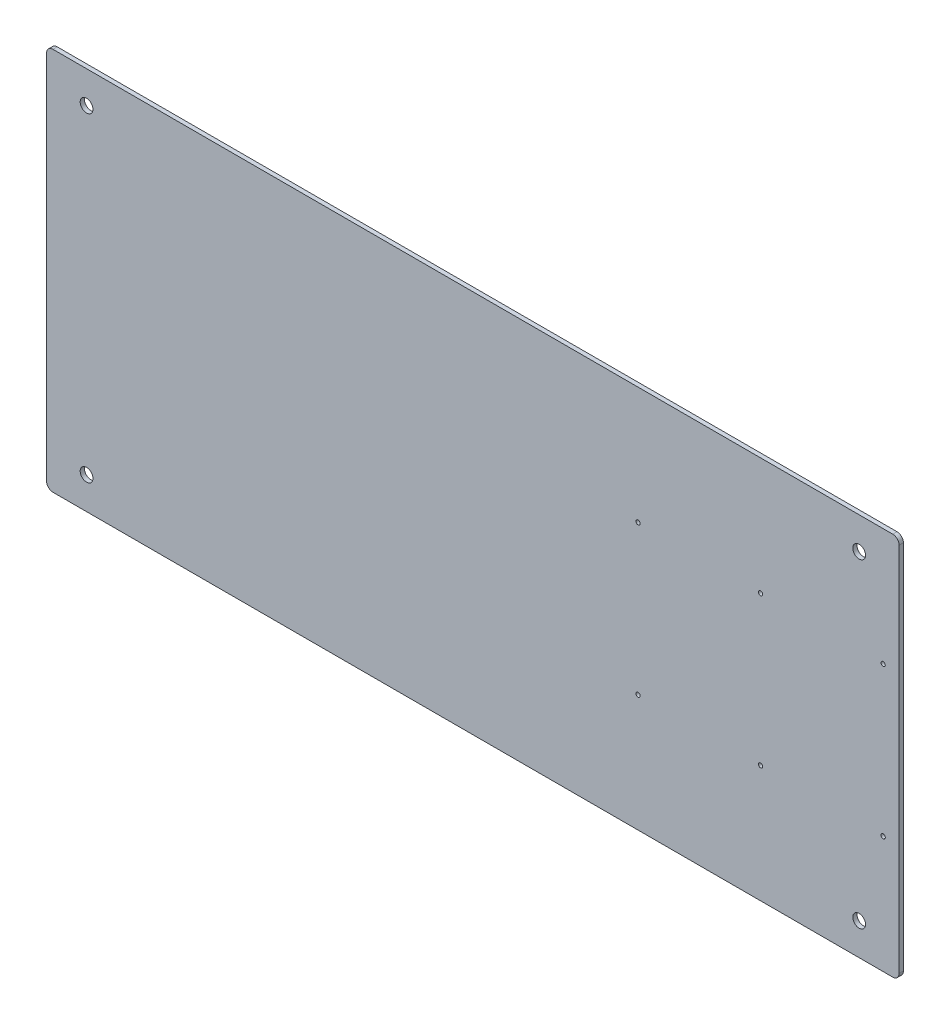
from build123d import *

# Parameters (mm, degrees)
SKETCH_1_W      = 800
SKETCH_1_H      = 360
SKETCH_1_R      = 6
SKETCH_1_R_2    = 2
EXTRUDE_1_DEPTH = 4
FILLET_1_R      = 6


with BuildPart() as part:
    # 草图1 → 凸台-拉伸1 (new body)
    with BuildSketch(Plane.XY):
        Rectangle(SKETCH_1_W, SKETCH_1_H)
        with Locations((-362.5, 150)):
            Circle(SKETCH_1_R, mode=Mode.SUBTRACT)
        with Locations((-362.5, -150)):
            Circle(SKETCH_1_R, mode=Mode.SUBTRACT)
        with Locations((362.5, -150)):
            Circle(SKETCH_1_R, mode=Mode.SUBTRACT)
        with Locations((362.5, 150)):
            Circle(SKETCH_1_R, mode=Mode.SUBTRACT)
        with Locations((155, 70)):
            Circle(SKETCH_1_R_2, mode=Mode.SUBTRACT)
        with Locations((270, 70)):
            Circle(SKETCH_1_R_2, mode=Mode.SUBTRACT)
        with Locations((385, 70)):
            Circle(SKETCH_1_R_2, mode=Mode.SUBTRACT)
        with Locations((385, -70)):
            Circle(SKETCH_1_R_2, mode=Mode.SUBTRACT)
        with Locations((270, -70)):
            Circle(SKETCH_1_R_2, mode=Mode.SUBTRACT)
        with Locations((155, -70)):
            Circle(SKETCH_1_R_2, mode=Mode.SUBTRACT)
    extrude(amount=EXTRUDE_1_DEPTH)

    # 圆角1
    fillet_1_edges = [part.edges().sort_by_distance(p)[0] for p in [
        (400, -180, 2),
        (-400, -180, 2),
        (-400, 180, 2),
        (400, 180, 2),
    ]]
    fillet(fillet_1_edges, radius=FILLET_1_R)


solid = part.part
